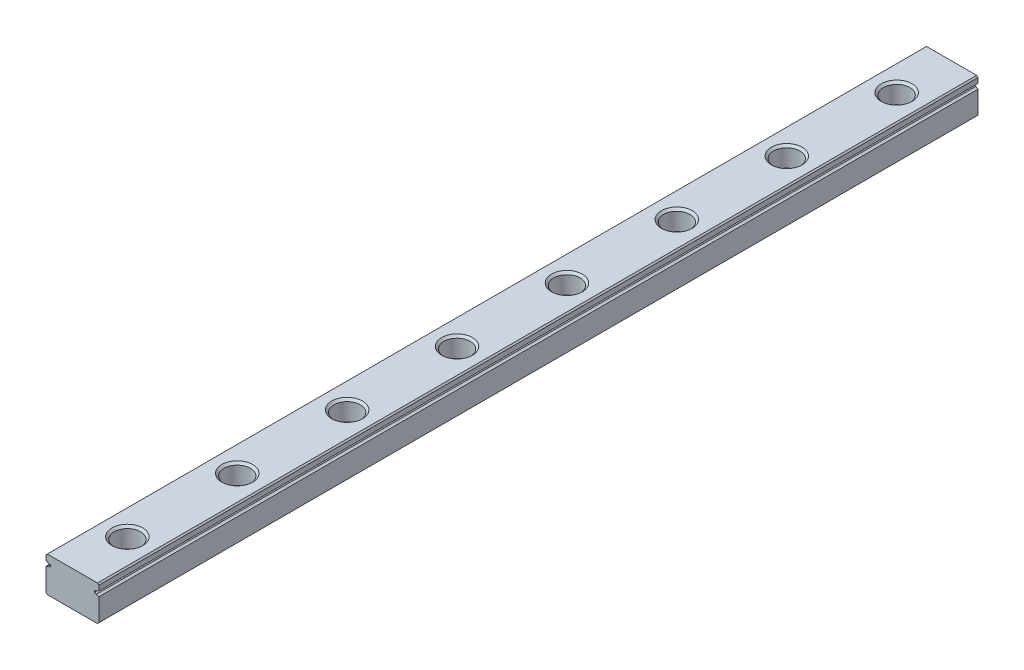
from build123d import *

# Parameters (mm, degrees)
BOSS_EXTRUDE1_DEPTH = 200
CHAMFER1_SIZE       = 0.3
LPATTERN1_COUNT     = 8
LPATTERN1_PITCH     = 25


with BuildPart() as part:
    # Sketch1 → Boss-Extrude1 (new body)
    with BuildSketch(Plane.XY):
        with BuildLine():
            Line((-6, 4), (6, 4))
            Line((6, 4), (6, 2.75))
            Line((6, 2.75), (6, 2.559016994))
            ThreePointArc((6, 2.559016994), (5.706107374, 2.475528258), (5.5, 2.25))
            Line((5.5, 2.25), (5, 2.25))
            Line((5, 2.25), (5, 1.75))
            Line((5, 1.75), (5.5, 1.75))
            ThreePointArc((5.5, 1.75), (5.706107374, 1.524471742), (6, 1.440983006))
            Line((6, 1.440983006), (6, 1.25))
            Line((6, 1.25), (6, -4))
            Line((6, -4), (-6, -4))
            Line((-6, -4), (-6, 1.25))
            Line((-6, 1.25), (-6, 1.440983006))
            ThreePointArc((-6, 1.440983006), (-5.706107374, 1.524471742), (-5.5, 1.75))
            Line((-5.5, 1.75), (-5, 1.75))
            Line((-5, 1.75), (-5, 2.25))
            Line((-5, 2.25), (-5.5, 2.25))
            ThreePointArc((-5.5, 2.25), (-5.706107374, 2.475528258), (-6, 2.559016994))
            Line((-6, 2.559016994), (-6, 2.75))
            Line((-6, 2.75), (-6, 4))
        make_face()
    extrude(amount=BOSS_EXTRUDE1_DEPTH)

    # Chamfer1
    chamfer1_edges = [part.edges().sort_by_distance(p)[0] for p in [
        (-6, 4, 100),
        (6, 4, 100),
        (6, -4, 100),
        (-6, -4, 100),
    ]]
    chamfer(chamfer1_edges, length=CHAMFER1_SIZE)

    # Sketch3 → M3 六角承窩頭蓋螺釘的柱孔1 (revolve, cut)
    with BuildSketch(Plane(origin=(0, 4, 12.5), x_dir=(0, 0, 1), z_dir=(1, 0, 0))):
        Polygon((0, 0), (0, 8), (2, 8), (1.75, 7.75), (1.75, 4.5), (3, 4.5), (3, 0.5), (3.5, 0), align=None)
    hole_wizard_m3_1 = revolve(axis=Axis((0, 10.35, 12.5), (0, -1, 0)), mode=Mode.SUBTRACT)

    # LPattern1: M3 六角承窩頭蓋螺釘的柱孔1 ×8
    with Locations(*[(0, 0, i * LPATTERN1_PITCH) for i in range(1, LPATTERN1_COUNT)]):
        add(hole_wizard_m3_1, mode=Mode.SUBTRACT)


solid = part.part
